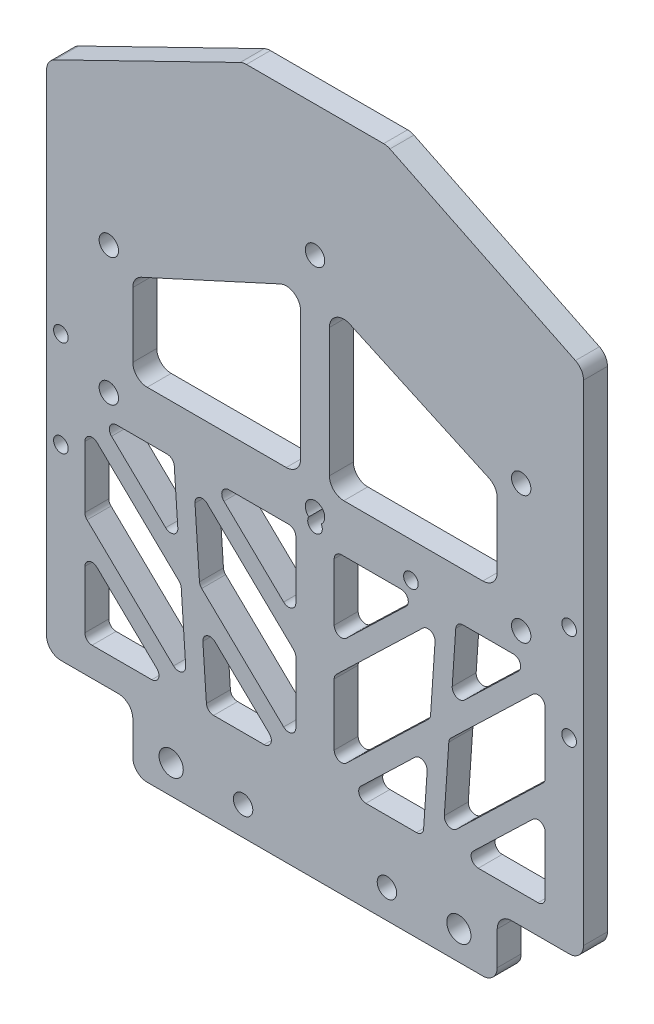
from build123d import *

# Parameters (mm, degrees)
SKETCH_1_W           = 112
SKETCH_1_H           = 140
EXTRUDE_1_DEPTH      = 2.5
CUT_EXTRUDE_2_DEPTH  = 5
SKETCH_4_R           = 2.025
CUT_EXTRUDE_3_DEPTH  = 10
SKETCH_6_W           = 18
SKETCH_6_H           = 13
CUT_EXTRUDE_5_DEPTH  = 10
CUT_EXTRUDE_6_DEPTH  = 5
FILLET_1_R           = 3
SKETCH_8_R           = 1.525
CUT_EXTRUDE_7_DEPTH  = 5
SKETCH_10_R          = 2.525
CUT_EXTRUDE_9_DEPTH  = 40
FILLET_3_R           = 3
CUT_EXTRUDE_10_DEPTH = 78
EXTRUDE_2_DEPTH      = 5
EXTRUDE_3_DEPTH      = 5
FILLET_4_R           = 1.5
EXTRUDE_6_DEPTH      = 5
SKETCH_22_R          = 1.525
CUT_EXTRUDE_15_DEPTH = 5
SKETCH_24_R          = 2.025
CUT_EXTRUDE_17_DEPTH = 10


with BuildPart() as part:
    # 草图1 → 凸台-拉伸1 (new, symmetric)
    with BuildSketch(Plane.XY):
        Rectangle(SKETCH_1_W, SKETCH_1_H)
    extrude(amount=EXTRUDE_1_DEPTH, both=True)

    # 草图3 → 切除-拉伸2 (cut)
    with BuildSketch(Plane.XY.offset(2.5)):
        Polygon((-15, 70), (-56, 50), (-56, 70), align=None)
        Polygon((56, 70), (15, 70), (56, 50), align=None)
    extrude(amount=-CUT_EXTRUDE_2_DEPTH, mode=Mode.SUBTRACT)

    # 草图4 → 切除-拉伸3 (cut)
    with BuildSketch(Plane.XY.offset(2.5)):
        with Locations((0, -3.65)):
            Circle(SKETCH_4_R)
        with Locations((43, -3.65)):
            Circle(SKETCH_4_R)
        with Locations((-43, -3.65)):
            Circle(SKETCH_4_R)
        with Locations((-43, 23)):
            Circle(SKETCH_4_R)
        with Locations((0, 42.696305337)):
            Circle(SKETCH_4_R)
        with Locations((43, 23)):
            Circle(SKETCH_4_R)
    extrude(amount=-CUT_EXTRUDE_3_DEPTH, mode=Mode.SUBTRACT)

    # 草图6 → 切除-拉伸5 (cut)
    with BuildSketch(Plane(origin=(0, 0, -2.5), x_dir=(-1, 0, 0), z_dir=(0, 0, -1))):
        with Locations((47, -63.5)):
            Rectangle(SKETCH_6_W, SKETCH_6_H)
    cut_extrude_5 = extrude(amount=-CUT_EXTRUDE_5_DEPTH, mode=Mode.SUBTRACT)

    # 镜向2: 切除-拉伸5 across plane
    add(cut_extrude_5.mirror(Plane(origin=(0, 0, 0), x_dir=(0, 0, 1), z_dir=(1, 0, 0))), mode=Mode.SUBTRACT)

    # 草图7 → 切除-拉伸6 (cut)
    with BuildSketch(Plane.XY.offset(2.5)):
        Polygon((-3, 1.35), (-3, 35.822569262), (-38, 19.790692824), (-38, 1.35), align=None)
        Polygon((38, 19.790692824), (3, 35.822569262), (3, 1.35), (38, 1.35), align=None)
    extrude(amount=-CUT_EXTRUDE_6_DEPTH, mode=Mode.SUBTRACT)

    # 圆角1
    fillet_1_edges = [part.edges().sort_by_distance(p)[0] for p in [
        (-38, 19.790692824, 0),
        (-38, 1.35, 0),
        (-3, 1.35, 0),
        (-3, 35.822569262, 0),
        (3, 1.35, 0),
        (38, 1.35, 0),
        (38, 19.790692824, 0),
        (3, 35.822569262, 0),
    ]]
    fillet(fillet_1_edges, radius=FILLET_1_R)

    # 草图8 → 切除-拉伸7 (cut)
    with BuildSketch(Plane(origin=(0, 0, -2.5), x_dir=(-1, 0, 0), z_dir=(0, 0, -1))):
        with Locations((-53, 2)):
            Circle(SKETCH_8_R)
        with Locations((-53, -18)):
            Circle(SKETCH_8_R)
    cut_extrude_7 = extrude(amount=-CUT_EXTRUDE_7_DEPTH, mode=Mode.SUBTRACT)

    # 镜向3: 切除-拉伸7 across plane
    add(cut_extrude_7.mirror(Plane(origin=(0, 0, 0), x_dir=(0, 0, 1), z_dir=(1, 0, 0))), mode=Mode.SUBTRACT)

    # 草图10 → 切除-拉伸9 (cut)
    with BuildSketch(Plane.XY.offset(2.5)):
        with Locations((-30, -64)):
            Circle(SKETCH_10_R)
        with Locations((30, -64)):
            Circle(SKETCH_10_R)
    extrude(amount=-CUT_EXTRUDE_9_DEPTH, mode=Mode.SUBTRACT)

    # 圆角3
    fillet_3_edges = [part.edges().sort_by_distance(p)[0] for p in [
        (-56, 50, 0),
        (-15, 70, 0),
        (15, 70, 0),
        (56, 50, 0),
        (-56, -57, 0),
        (-38, -70, 0),
        (-38, -57, 0),
        (56, -57, 0),
        (38, -57, 0),
        (38, -70, 0),
    ]]
    fillet(fillet_3_edges, radius=FILLET_3_R)

    # 草图11 → 切除-拉伸10 (cut)
    with BuildSketch(Plane(origin=(0, 0, -2.5), x_dir=(-1, 0, 0), z_dir=(0, 0, -1))):
        Polygon((-6.884052732, -51), (-48, -11.425900755), (-48, -51), align=None)
        Polygon((-4, -8.65), (-45.115947268, -8.65), (-4, -48.224099245), align=None)
    cut_extrude_10 = extrude(amount=-CUT_EXTRUDE_10_DEPTH, mode=Mode.SUBTRACT)

    # 草图12 → 凸台-拉伸2 (add)
    with BuildSketch(Plane(origin=(0, 0, -2.5), x_dir=(-1, 0, 0), z_dir=(0, 0, -1))):
        Polygon((-27.442026366, -8.65), (-4, -31.212950377), (-2.613062807, -26.996075916), (-23.171036441, -7.209026293), align=None)
        Polygon((-49.386937193, -32.653924084), (-28.828963559, -52.440973707), (-24.557973634, -51), (-48, -28.437049623), align=None)
    extrude_2 = extrude(amount=-EXTRUDE_2_DEPTH)

    # 草图13 → 凸台-拉伸3 (add)
    with BuildSketch(Plane(origin=(0, 0, -2.5), x_dir=(-1, 0, 0), z_dir=(0, 0, -1))):
        Polygon((-29.446658669, -8.65), (-26.553352036, -51.135886105), (-22.553341331, -51), (-25.446647964, -8.514113895), align=None)
    extrude_3 = extrude(amount=-EXTRUDE_3_DEPTH)

    # 镜向5: 切除-拉伸10, 凸台-拉伸2, 凸台-拉伸3 across plane
    add(cut_extrude_10.mirror(Plane(origin=(0, 0, 0), x_dir=(0, 0, 1), z_dir=(1, 0, 0))), mode=Mode.SUBTRACT)
    add(extrude_2.mirror(Plane(origin=(0, 0, 0), x_dir=(0, 0, 1), z_dir=(1, 0, 0))))
    add(extrude_3.mirror(Plane(origin=(0, 0, 0), x_dir=(0, 0, 1), z_dir=(1, 0, 0))))

    # 圆角4
    fillet_4_edges = [part.edges().sort_by_distance(p)[0] for p in [
        (4, -48.224099245, 0),
        (45.115947268, -8.65, 0),
        (4, -8.65, 0),
        (6.884052732, -51, 0),
        (48, -51, 0),
        (48, -11.425900755, 0),
        (4, -25.661148868, 0),
        (21.673920902, -8.65, 0),
        (4, -31.212950377, 0),
        (48, -33.988851132, 0),
        (30.326079098, -51, 0),
        (48, -28.437049623, 0),
        (26.703219631, -48.935200727, 0),
        (25.296780369, -10.714799273, 0),
        (23.652453905, -34.860413872, 0),
        (27.942945899, -30.730815326, 0),
        (29.446658669, -8.65, 0),
        (24.057054101, -28.919184674, 0),
        (22.553341331, -51, 0),
        (28.347546095, -24.789586128, 0),
        (-45.115947268, -8.65, 0),
        (-4, -48.224099245, 0),
        (-4, -8.65, 0),
        (-48, -51, 0),
        (-6.884052732, -51, 0),
        (-48, -11.425900755, 0),
        (-21.673920902, -8.65, 0),
        (-4, -25.661148868, 0),
        (-4, -31.212950377, 0),
        (-48, -33.988851132, 0),
        (-30.326079098, -51, 0),
        (-48, -28.437049623, 0),
        (-26.703219631, -48.935200727, 0),
        (-25.296780369, -10.714799273, 0),
        (-23.652453905, -34.860413872, 0),
        (-24.057054101, -28.919184674, 0),
        (-22.553341331, -51, 0),
        (-27.942945899, -30.730815326, 0),
        (-28.347546095, -24.789586128, 0),
        (-29.446658669, -8.65, 0),
    ]]
    fillet(fillet_4_edges, radius=FILLET_4_R)

    # 草图21 → 凸台-拉伸6 (add)
    with BuildSketch(Plane(origin=(0, 0, -2.5), x_dir=(-1, 0, 0), z_dir=(0, 0, -1))):
        with BuildLine():
            Line((-20, -3), (-25.822161429, -3))
            Line((-25.822161429, -3), (-25.413558917, -9))
            Line((-25.413558917, -9), (-20, -9))
            ThreePointArc((-20, -9), (-17, -6), (-20, -3))
        make_face()
    extrude(amount=-EXTRUDE_6_DEPTH)

    # 草图22 → 切除-拉伸15 (cut)
    with BuildSketch(Plane(origin=(0, 0, -2.5), x_dir=(-1, 0, 0), z_dir=(0, 0, -1))):
        with Locations((0, -6)):
            Circle(SKETCH_22_R)
        with Locations((-20, -6)):
            Circle(SKETCH_22_R)
    extrude(amount=-CUT_EXTRUDE_15_DEPTH, mode=Mode.SUBTRACT)

    # 草图24 → 切除-拉伸17 (cut)
    with BuildSketch(Plane.XY.offset(2.5)):
        with Locations((-15, -64)):
            Circle(SKETCH_24_R)
        with Locations((15, -64)):
            Circle(SKETCH_24_R)
    extrude(amount=-CUT_EXTRUDE_17_DEPTH, mode=Mode.SUBTRACT)


solid = part.part
